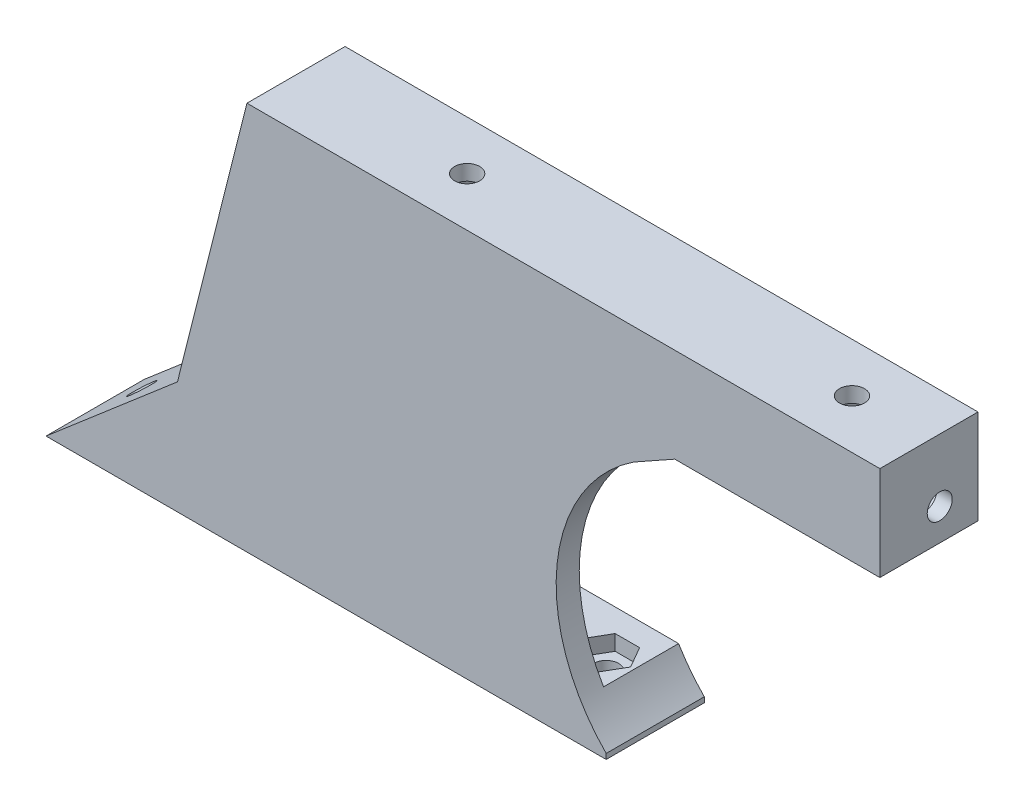
from build123d import *

# Parameters (mm, degrees)
SALIENTE_EXTRUIR1_DEPTH = 3
SALIENTE_EXTRUIR2_DEPTH = 9.75
CROQUIS4_R              = 1.625
CORTAR_EXTRUIR1_DEPTH   = 5
CORTAR_EXTRUIR2_DEPTH   = 2
CROQUIS6_R              = 1.625
CORTAR_EXTRUIR3_DEPTH   = 9
CORTAR_EXTRUIR4_DEPTH   = 10
CROQUIS10_R             = 1.625
SALIENTE_EXTRUIR3_DEPTH = 2
CORTAR_EXTRUIR5_DEPTH   = 5
CROQUIS14_R             = 1.625
SALIENTE_EXTRUIR4_DEPTH = 3
CROQUIS15_R             = 1.625
CORTAR_EXTRUIR6_DEPTH   = 4
CORTAR_EXTRUIR7_DEPTH   = 2
CROQUIS17_R             = 1.625
CORTAR_EXTRUIR9_DEPTH   = 4
CORTAR_EXTRUIR10_DEPTH  = 2


with BuildPart() as part:
    # Croquis1 → Saliente-Extruir1 (new body)
    with BuildSketch(Plane.XY):
        with BuildLine():
            Line((-46.67593732, 50.511923567), (-55.699999998, 14.642073221))
            Line((-55.699999998, 14.642073221), (-72.78319995, 0))
            Line((-72.78319995, 0), (0, 0))
            Line((0, 0), (0, 0.68070798))
            ThreePointArc((0, 0.68070798), (-6.381456753, 18.806597842), (3.562657036, 35.25))
            Line((3.562657036, 35.25), (8.913300435, 38.25))
            Line((8.913300435, 38.25), (35.562657036, 38.25))
            Line((35.562657036, 38.25), (35.562657036, 50.511923567))
            Line((35.562657036, 50.511923567), (-46.67593732, 50.511923567))
        make_face()
    extrude(amount=-SALIENTE_EXTRUIR1_DEPTH)

    # Croquis2 → Saliente-Extruir2 (add)
    with BuildSketch(Plane(origin=(0, 0, -3), x_dir=(-1, 0, 0), z_dir=(0, 0, -1))):
        with BuildLine():
            Line((42.526447804, 46.511923567), (51.238983488, 11.880365447))
            Line((51.238983488, 11.880365447), (59.266443595, 5))
            Line((59.266443595, 5), (3.339079606, 5))
            ThreePointArc((3.339079606, 5), (1.801031086, 2.738703104), (0, 0.68070798))
            Line((0, 0.68070798), (0, 0))
            Line((0, 0), (72.78319995, 0))
            Line((72.78319995, 0), (55.699999998, 14.642073221))
            Line((55.699999998, 14.642073221), (46.67593732, 50.511923567))
            Line((46.67593732, 50.511923567), (-35.562657036, 50.511923567))
            Line((-35.562657036, 50.511923567), (-35.562657036, 38.25))
            Line((-35.562657036, 38.25), (-31.562657036, 38.25))
            Line((-31.562657036, 38.25), (-31.562657036, 46.511923567))
            Line((-31.562657036, 46.511923567), (42.526447804, 46.511923567))
        make_face()
    extrude(amount=SALIENTE_EXTRUIR2_DEPTH)

    # Croquis4 → Cortar-Extruir1 (cut)
    with BuildSketch(Plane.XZ):
        with Locations((-6.999999998, -7)):
            Circle(CROQUIS4_R)
        with Locations((-52.78319995, -7)):
            Circle(CROQUIS4_R)
    extrude(amount=-CORTAR_EXTRUIR1_DEPTH, mode=Mode.SUBTRACT)

    # Croquis5 → Cortar-Extruir2 (cut)
    with BuildSketch(Plane(origin=(0, 5, 0), x_dir=(1, 0, 0), z_dir=(0, 1, 0))):
        Polygon((-10.179999998, 7), (-8.589999998, 4.246039216), (-5.409999998, 4.246039216), (-3.819999998, 7), (-5.409999998, 9.753960784), (-8.589999998, 9.753960784), align=None)
        Polygon((-49.60319995, 7), (-51.19319995, 9.753960784), (-54.37319995, 9.753960784), (-55.96319995, 7), (-54.37319995, 4.246039216), (-51.19319995, 4.246039216), align=None)
    extrude(amount=-CORTAR_EXTRUIR2_DEPTH, mode=Mode.SUBTRACT)

    # Croquis6 → Cortar-Extruir3 (cut)
    with BuildSketch(Plane(origin=(-30.824200619, 35.963211942, 0), x_dir=(0.7592713073348841, 0.6507742172658472, 0), z_dir=(-0.6507742172658472, 0.7592713073348842, 0))):
        with Locations(Location((-47.262195378, 6.375, 0), (0, 0, 180))):
            Circle(CROQUIS6_R)
    extrude(amount=-CORTAR_EXTRUIR3_DEPTH, mode=Mode.SUBTRACT)

    # Croquis9 → Cortar-Extruir4 (cut)
    with BuildSketch(Plane(origin=(-30.824200619, 35.963211942, 0), x_dir=(0.7592713073348841, 0.6507742172658472, 0), z_dir=(-0.6507742172658472, 0.7592713073348842, 0))):
        Polygon((-50.432195378, 6.375), (-48.847195378, 3.62969947), (-45.677195378, 3.62969947), (-44.092195378, 6.375), (-45.677195378, 9.12030053), (-48.847195378, 9.12030053), align=None)
    extrude(amount=-CORTAR_EXTRUIR4_DEPTH, mode=Mode.SUBTRACT)

    # Croquis10 → Saliente-Extruir3 (add)
    with BuildSketch(Plane(origin=(-30.824200619, 35.963211942, 0), x_dir=(0.7592713073348841, 0.6507742172658472, 0), z_dir=(-0.6507742172658472, 0.7592713073348842, 0))):
        Polygon((-50.432195378, 6.375), (-48.847195378, 3.62969947), (-45.677195378, 3.62969947), (-44.092195378, 6.375), (-45.677195378, 9.12030053), (-48.847195378, 9.12030053), align=None)
        with Locations(Location((-47.262195378, 6.375, 0), (0, 0, 180))):
            Circle(CROQUIS10_R, mode=Mode.SUBTRACT)
    extrude(amount=-SALIENTE_EXTRUIR3_DEPTH)

    # Croquis13 → Cortar-Extruir5 (cut)
    with BuildSketch(Plane(origin=(-55.848866467, 14.050342186, 0), x_dir=(0, 0, 1), z_dir=(-0.9697813730803216, 0.243975589816781, 0))):
        Polygon((-6.375, 20.547396855), (-3.621039216, 22.137396855), (-3.621039216, 25.317396855), (-6.375, 26.907396855), (-9.128960784, 25.317396855), (-9.128960784, 22.137396855), align=None)
    extrude(amount=-CORTAR_EXTRUIR5_DEPTH, mode=Mode.SUBTRACT)

    # Croquis14 → Saliente-Extruir4 (add)
    with BuildSketch(Plane(origin=(-55.848866467, 14.050342186, 0), x_dir=(0, 0, 1), z_dir=(-0.9697813730803216, 0.243975589816781, 0))):
        Polygon((-6.375, 26.907396855), (-9.128960784, 25.317396855), (-9.128960784, 22.137396855), (-6.375, 20.547396855), (-3.621039216, 22.137396855), (-3.621039216, 25.317396855), align=None)
        with Locations(Location((-6.375, 23.727396855, 0), (0, 0, 270))):
            Circle(CROQUIS14_R, mode=Mode.SUBTRACT)
    extrude(amount=-SALIENTE_EXTRUIR4_DEPTH)

    # Croquis15 → Cortar-Extruir6 (cut)
    with BuildSketch(Plane(origin=(0, 50.511923567, 0), x_dir=(1, 0, 0), z_dir=(0, 1, 0))):
        with Locations(Location((25.562657036, 6.375, 0), (0, 0, 180))):
            Circle(CROQUIS15_R)
        with Locations(Location((-24.437342964, 6.375, 0), (0, 0, 180))):
            Circle(CROQUIS15_R)
    extrude(amount=-CORTAR_EXTRUIR6_DEPTH, mode=Mode.SUBTRACT)

    # Croquis16 → Cortar-Extruir7 (cut)
    with BuildSketch(Plane.XZ.offset(-46.511923567)):
        Polygon((22.382657036, -6.375), (23.972657036, -9.128960784), (27.152657036, -9.128960784), (28.742657036, -6.375), (27.152657036, -3.621039216), (23.972657036, -3.621039216), align=None)
        Polygon((-21.257342964, -6.375), (-22.847342964, -3.621039216), (-26.027342964, -3.621039216), (-27.617342964, -6.375), (-26.027342964, -9.128960784), (-22.847342964, -9.128960784), align=None)
    extrude(amount=-CORTAR_EXTRUIR7_DEPTH, mode=Mode.SUBTRACT)

    # Croquis17 → Cortar-Extruir9 (cut)
    with BuildSketch(Plane(origin=(35.562657036, 0, 0), x_dir=(0, 0, -1), z_dir=(1, 0, 0))):
        with Locations(Location((7.777494034, 42.38, 0), (0, 0, 90))):
            Circle(CROQUIS17_R)
    extrude(amount=-CORTAR_EXTRUIR9_DEPTH, mode=Mode.SUBTRACT)

    # Croquis18 → Cortar-Extruir10 (cut)
    with BuildSketch(Plane.ZY.offset(-31.562657036)):
        Polygon((-7.777494034, 39.2), (-5.02353325, 40.79), (-5.02353325, 43.97), (-7.777494034, 45.56), (-10.531454818, 43.97), (-10.531454818, 40.79), align=None)
    extrude(amount=-CORTAR_EXTRUIR10_DEPTH, mode=Mode.SUBTRACT)


solid = part.part
